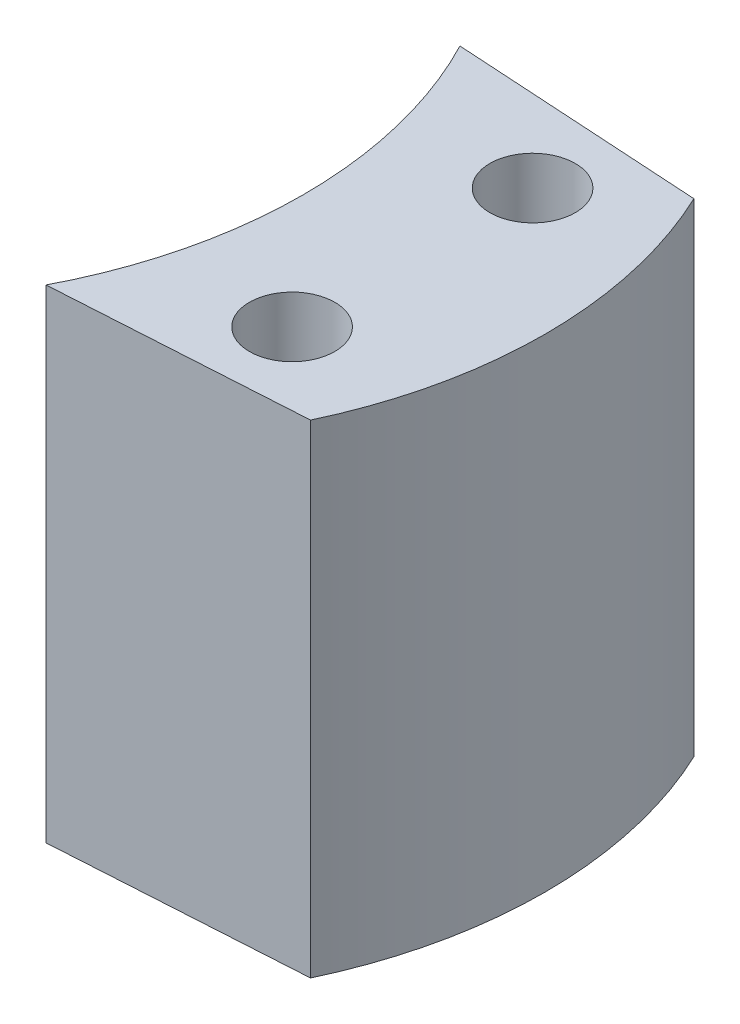
from build123d import *

# Parameters (mm, degrees)
SKETCH1_R           = 1.9
BOSS_EXTRUDE3_DEPTH = 21.5


with BuildPart() as part:
    # Sketch1 → Boss-Extrude3 (new body)
    with BuildSketch(Plane(origin=(0, 0, 0), x_dir=(1, 0, 0), z_dir=(0, 1, 0))):
        with BuildLine():
            Line((0, 9.208278243), (11.089751242, 8.53))
            ThreePointArc((11.089751242, 8.53), (13, 0), (11.089751242, -8.53))
            Line((11.089751242, -8.53), (0, -9.208278243))
            ThreePointArc((0, -9.208278243), (2.245912814, 0), (0, 9.208278243))
        make_face()
        with Locations(Location((7.089751242, -5.35, 0), (0, 0, 270))):
            Circle(SKETCH1_R, mode=Mode.SUBTRACT)
        with Locations(Location((7.089751242, 5.35, 0), (0, 0, 270))):
            Circle(SKETCH1_R, mode=Mode.SUBTRACT)
    extrude(amount=BOSS_EXTRUDE3_DEPTH)


solid = part.part
